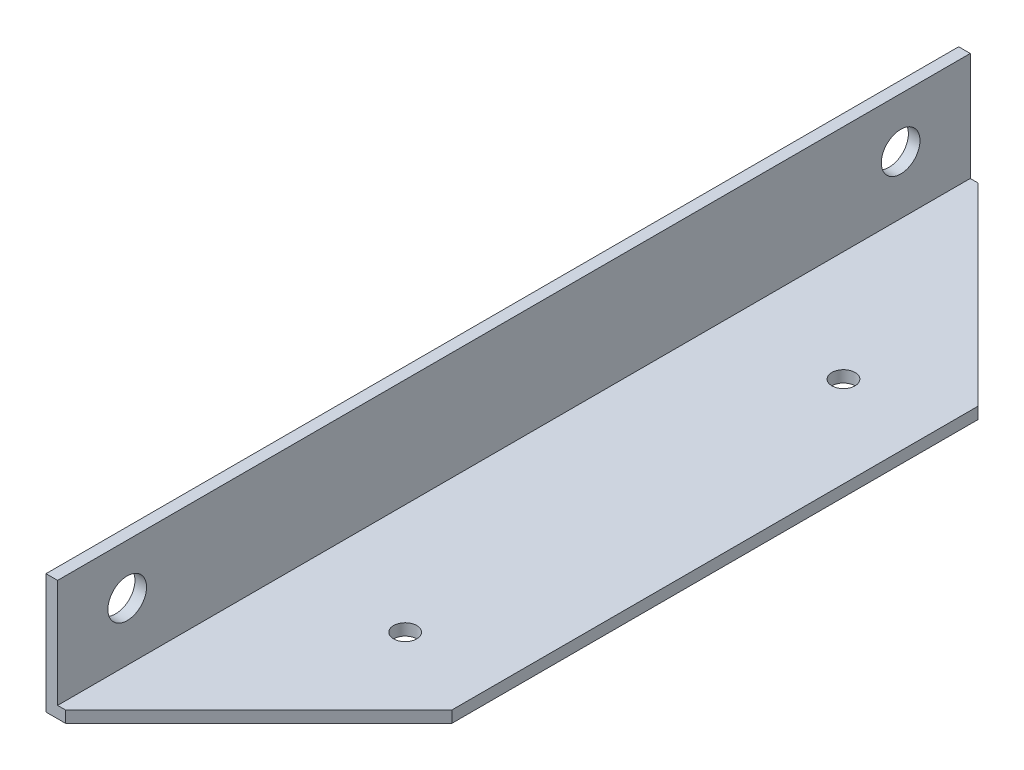
from build123d import *

# Parameters (mm, degrees)
EXTRU_MINCE1_DEPTH      = 118
ESQUISSE2_R             = 2.5
ENL_V_MAT_EXTRU_1_DEPTH = 4
ESQUISSE3_R             = 1.5
ENL_V_MAT_EXTRU_2_DEPTH = 4
CHANFREIN1_SIZE         = 25


with BuildPart() as part:
    # Esquisse1 → Extru.-Mince1 (new body)
    with BuildSketch(Plane.XY):
        Polygon((0, 15.5), (0, 0), (27.5, 0), (27.5, 1.5), (1.5, 1.5), (1.5, 15.5), align=None)
    extrude(amount=EXTRU_MINCE1_DEPTH)

    # Esquisse2 → Enlèv. mat.-Extru.1 (cut)
    with BuildSketch(Plane.ZY):
        with Locations(Location((9, 9, 0), (0, 0, 270))):
            Circle(ESQUISSE2_R)
        with Locations(Location((109, 9, 0), (0, 0, 90))):
            Circle(ESQUISSE2_R)
    extrude(amount=-ENL_V_MAT_EXTRU_1_DEPTH, mode=Mode.SUBTRACT)

    # Esquisse3 → Enlèv. mat.-Extru.2 (cut)
    with BuildSketch(Plane.XZ):
        with Locations(Location((15.771636742, 30.664864187, 0), (0, 0, 270))):
            Circle(ESQUISSE3_R)
        with Locations(Location((15.771636742, 87.335135813, 0), (0, 0, 90))):
            Circle(ESQUISSE3_R)
    extrude(amount=-ENL_V_MAT_EXTRU_2_DEPTH, mode=Mode.SUBTRACT)

    # Chanfrein1
    chanfrein1_edges = [part.edges().sort_by_distance(p)[0] for p in [
        (27.5, 0.75, 0),
        (27.5, 0.75, 118),
    ]]
    chamfer(chanfrein1_edges, length=CHANFREIN1_SIZE)


solid = part.part
